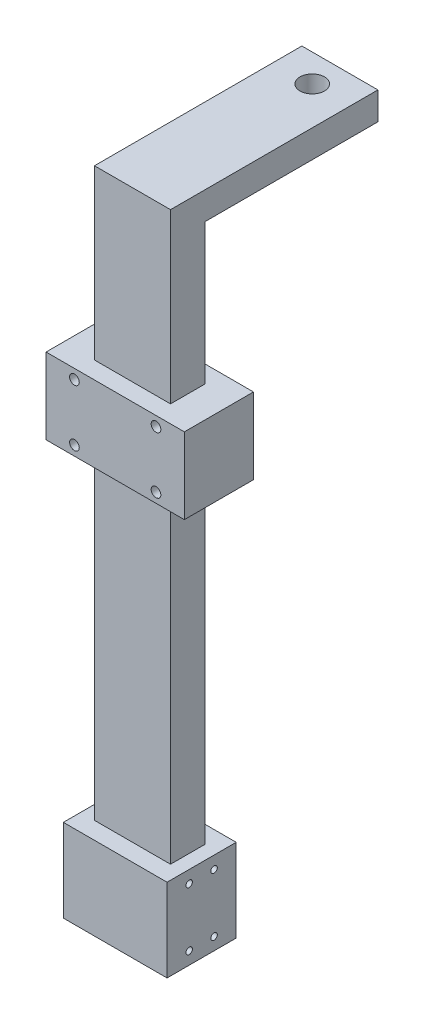
from build123d import *

# Parameters (mm, degrees)
SKETCH1_W                = 13.97
SKETCH1_H                = 6.35
BOSS_EXTRUDE1_DEPTH      = 114.3
SKETCH3_W                = 25.4
SKETCH3_H                = 13.97
BOSS_EXTRUDE3_DEPTH      = 6.35
BOSS_EXTRUDE5_DEPTH      = 9.525
BOSS_EXTRUDE5_DEPTH_BACK = 9.525
SKETCH5_W                = 12.7
SKETCH5_H                = 15.24
SKETCH6_W                = 13.97
SKETCH6_H                = 38.1
BOSS_EXTRUDE6_DEPTH      = 5.08
SKETCH7_R                = 2.25
CUT_EXTRUDE1_DEPTH       = 5.08
SKETCH8_R                = 0.59563
CUT_EXTRUDE2_DEPTH       = 127.353831165
SKETCH9_R                = 0.889
CUT_EXTRUDE3_DEPTH       = 126.954294885
BOSS_EXTRUDE7_DEPTH      = 6.35
BOSS_EXTRUDE7_DEPTH_BACK = 6.35
SKETCH10_W               = 25.4
SKETCH10_H               = 13.97
SKETCH10_R               = 0.889


with BuildPart() as part:
    # Sketch1 → Boss-Extrude1 (new body)
    with BuildSketch(Plane(origin=(0, 0, 0), x_dir=(1, 0, 0), z_dir=(0, 1, 0))):
        Rectangle(SKETCH1_W, SKETCH1_H)
    extrude(amount=BOSS_EXTRUDE1_DEPTH)

    # Sketch3 → Boss-Extrude3 (add)
    with BuildSketch(Plane.XY.offset(3.175)):
        with Locations((0, 81.491176781)):
            Rectangle(SKETCH3_W, SKETCH3_H)
    extrude(amount=-BOSS_EXTRUDE3_DEPTH)

    # Sketch5 → Boss-Extrude5 (add, two sides: drawn at the far end of the back side and taken through both)
    with BuildSketch(Plane(origin=(0, 0, 0), x_dir=(0, 0, -1), z_dir=(1, 0, 0)).offset(-BOSS_EXTRUDE5_DEPTH_BACK)):
        with Locations((0, 7.62)):
            Rectangle(SKETCH5_W, SKETCH5_H)
    extrude(amount=BOSS_EXTRUDE5_DEPTH + BOSS_EXTRUDE5_DEPTH_BACK)

    # Sketch6 → Boss-Extrude6 (add)
    with BuildSketch(Plane(origin=(0, 114.3, 0), x_dir=(1, 0, 0), z_dir=(0, 1, 0))):
        with Locations((0, 15.875)):
            Rectangle(SKETCH6_W, SKETCH6_H)
    extrude(amount=BOSS_EXTRUDE6_DEPTH)

    # Sketch7 → Cut-Extrude1 (cut)
    with BuildSketch(Plane(origin=(0, 119.38, 0), x_dir=(1, 0, 0), z_dir=(0, 1, 0))):
        with Locations(Location((0, 29.845, 0), (0, 0, 270))):
            Circle(SKETCH7_R)
    extrude(amount=-CUT_EXTRUDE1_DEPTH, mode=Mode.SUBTRACT)

    # Sketch8 → Cut-Extrude2 (cut, through all)
    with BuildSketch(Plane.ZY.offset(9.525)):
        with Locations((-2.286, 12.954)):
            Circle(SKETCH8_R)
        with Locations((2.286, 12.954)):
            Circle(SKETCH8_R)
        with Locations((2.286, 2.286)):
            Circle(SKETCH8_R)
        with Locations((-2.286, 2.286)):
            Circle(SKETCH8_R)
    extrude(amount=-CUT_EXTRUDE2_DEPTH, mode=Mode.SUBTRACT)

    # Sketch9 → Cut-Extrude3 (cut, through all)
    with BuildSketch(Plane.XY.offset(3.175)):
        with Locations((-7.493, 86.698176781)):
            Circle(SKETCH9_R)
        with Locations((7.493, 86.698176781)):
            Circle(SKETCH9_R)
        with Locations((7.493, 76.284176781)):
            Circle(SKETCH9_R)
        with Locations((-7.493, 76.284176781)):
            Circle(SKETCH9_R)
    extrude(amount=-CUT_EXTRUDE3_DEPTH, mode=Mode.SUBTRACT)

    # Sketch10 → Boss-Extrude7 (add, two sides: drawn at the far end of the back side and taken through both)
    with BuildSketch(Plane.XY.offset(-BOSS_EXTRUDE7_DEPTH_BACK)):
        with Locations((0, 81.491176781)):
            Rectangle(SKETCH10_W, SKETCH10_H)
        with Locations((-7.493, 86.698176781)):
            Circle(SKETCH10_R, mode=Mode.SUBTRACT)
        with Locations((-7.493, 76.284176781)):
            Circle(SKETCH10_R, mode=Mode.SUBTRACT)
        with Locations((7.493, 76.284176781)):
            Circle(SKETCH10_R, mode=Mode.SUBTRACT)
        with Locations((7.493, 86.698176781)):
            Circle(SKETCH10_R, mode=Mode.SUBTRACT)
    extrude(amount=BOSS_EXTRUDE7_DEPTH + BOSS_EXTRUDE7_DEPTH_BACK)


solid = part.part
